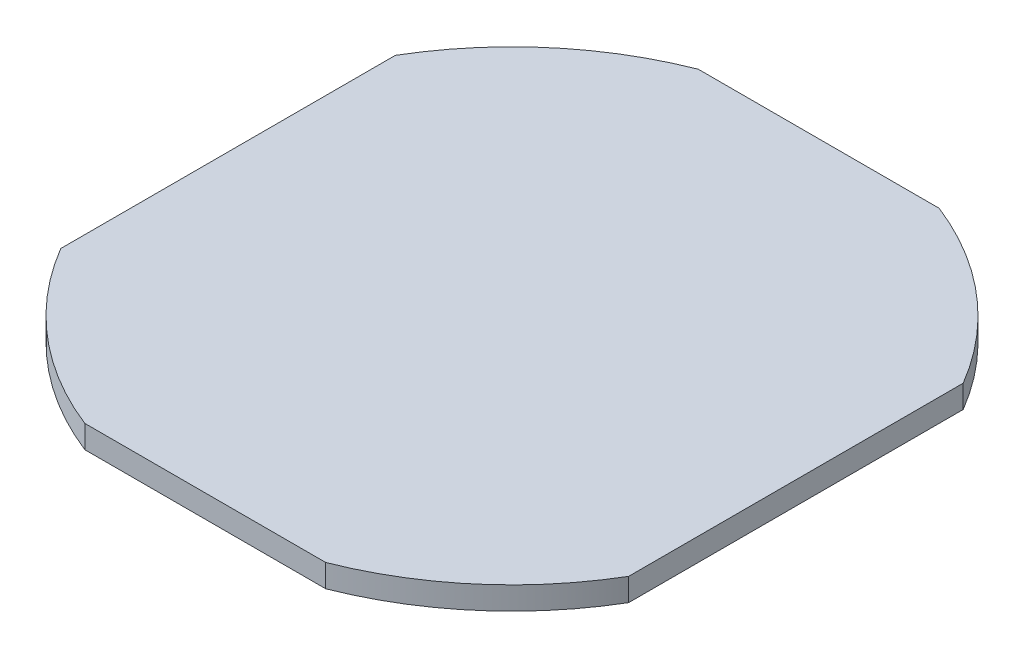
from build123d import *

# Parameters (mm, degrees)
BOSS_EXTRUDE1_DEPTH = 5


with BuildPart() as part:
    # Sketch1 → Boss-Extrude1 (new body)
    with BuildSketch(Plane(origin=(0, 0, 0), x_dir=(1, 0, 0), z_dir=(0, 1, 0))):
        with BuildLine():
            Line((-26.410225292, -67.25), (26.410225292, -67.25))
            ThreePointArc((26.410225292, -67.25), (46.892196974, -54.965301445), (62.25, -36.674241642))
            Line((62.25, -36.674241642), (62.25, 36.674241642))
            ThreePointArc((62.25, 36.674241642), (46.892196974, 54.965301445), (26.410225292, 67.25))
            Line((26.410225292, 67.25), (-26.410225292, 67.25))
            ThreePointArc((-26.410225292, 67.25), (-46.892196974, 54.965301445), (-62.25, 36.674241642))
            Line((-62.25, 36.674241642), (-62.25, -36.674241642))
            ThreePointArc((-62.25, -36.674241642), (-46.892196974, -54.965301445), (-26.410225292, -67.25))
        make_face()
    extrude(amount=BOSS_EXTRUDE1_DEPTH)


solid = part.part
